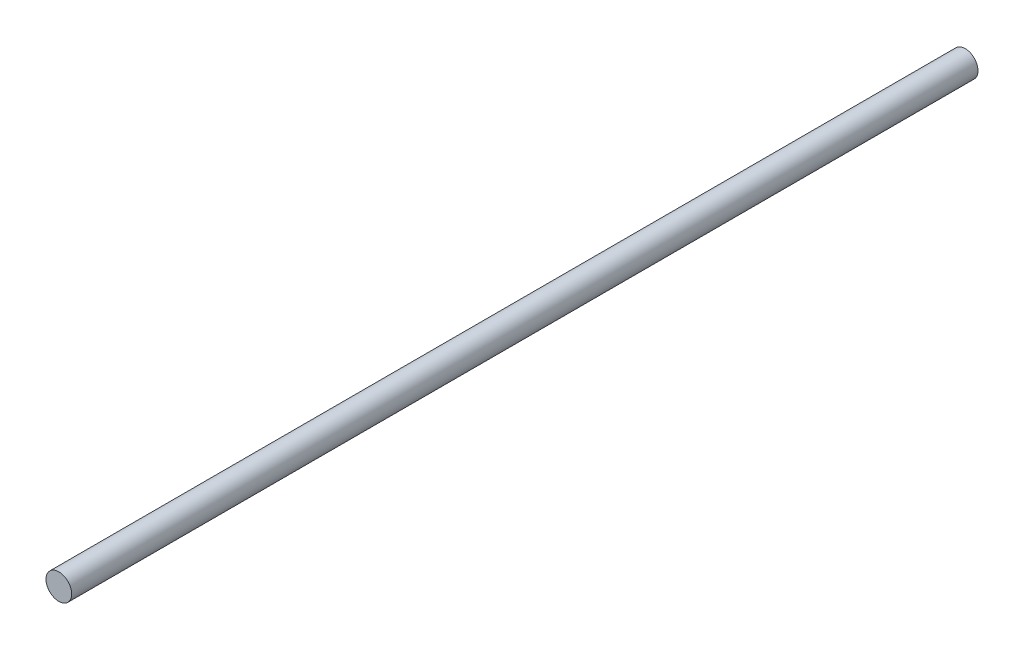
from build123d import *

# Parameters (mm, degrees)
SKETCH1_R           = 1.7
BOSS_EXTRUDE1_DEPTH = 120


with BuildPart() as part:
    # Sketch1 → Boss-Extrude1 (new body)
    with BuildSketch(Plane.XY):
        Circle(SKETCH1_R)
    extrude(amount=BOSS_EXTRUDE1_DEPTH)


solid = part.part
